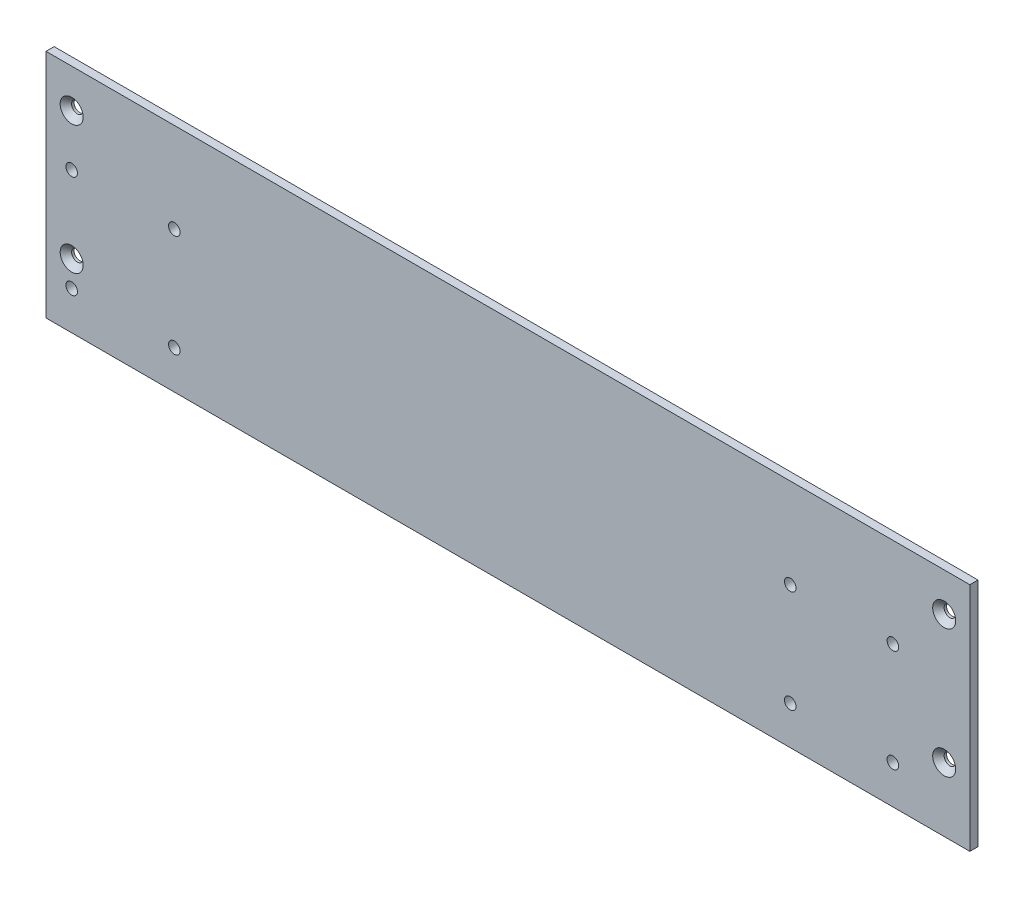
from build123d import *

# Parameters (mm, degrees)
SKETCH1_W                    = 360
SKETCH1_H                    = 90
BOSS_EXTRUDE1_DEPTH          = 3.175
M4_CLEARANCE_HOLE1_D         = 4.5
CSK_FOR_M4_SFHCS1_AT_2_COUNT = 2
CSK_FOR_M4_SFHCS1_AT_2_PITCH = 343.656805549
CSK_FOR_M4_SFHCS1_AT_3_COUNT = 2
CSK_FOR_M4_SFHCS1_AT_3_PITCH = 340
CSK_FOR_M4_SFHCS1_AT_4_COUNT = 2
CSK_FOR_M4_SFHCS1_AT_4_PITCH = 50


with BuildPart() as part:
    # Sketch1 → Boss-Extrude1 (new body)
    with BuildSketch(Plane.XY):
        Rectangle(SKETCH1_W, SKETCH1_H)
    extrude(amount=BOSS_EXTRUDE1_DEPTH)

    # M4 Clearance Hole1 (through all)
    with Locations(Plane.XY.offset(3.175)):
        with Locations((-130, 10), (-170, -30), (-170, 10), (-130, -30), (110, 10), (150, 10), (150, -30), (110, -30)):
            Hole(M4_CLEARANCE_HOLE1_D / 2)

    # Sketch7 → CSK for M4 SFHCS1 (revolve, cut)
    with BuildSketch(Plane(origin=(170, 30, 3.175), x_dir=(0, -1, 0), z_dir=(1, 0, 0))):
        Polygon((0, 0), (0, 3.175), (2.25, 3.175), (2.25, 2.23), (4.48, 0), align=None)
    csk_for_m4_sfhcs1 = revolve(axis=Axis((170, 30, 9.525), (0, 0, -1)), mode=Mode.SUBTRACT)

    # CSK for M4 SFHCS1 at 2: CSK for M4 SFHCS1 ×2
    with Locations(*[Vector(-0.9893591353648533, -0.1454939904948314, 0) * (i * CSK_FOR_M4_SFHCS1_AT_2_PITCH) for i in range(1, CSK_FOR_M4_SFHCS1_AT_2_COUNT)]):
        add(csk_for_m4_sfhcs1, mode=Mode.SUBTRACT)

    # CSK for M4 SFHCS1 at 3: CSK for M4 SFHCS1 ×2
    with Locations(*[(-i * CSK_FOR_M4_SFHCS1_AT_3_PITCH, 0, 0) for i in range(1, CSK_FOR_M4_SFHCS1_AT_3_COUNT)]):
        add(csk_for_m4_sfhcs1, mode=Mode.SUBTRACT)

    # CSK for M4 SFHCS1 at 4: CSK for M4 SFHCS1 ×2
    with Locations(*[(0, -i * CSK_FOR_M4_SFHCS1_AT_4_PITCH, 0) for i in range(1, CSK_FOR_M4_SFHCS1_AT_4_COUNT)]):
        add(csk_for_m4_sfhcs1, mode=Mode.SUBTRACT)


solid = part.part
